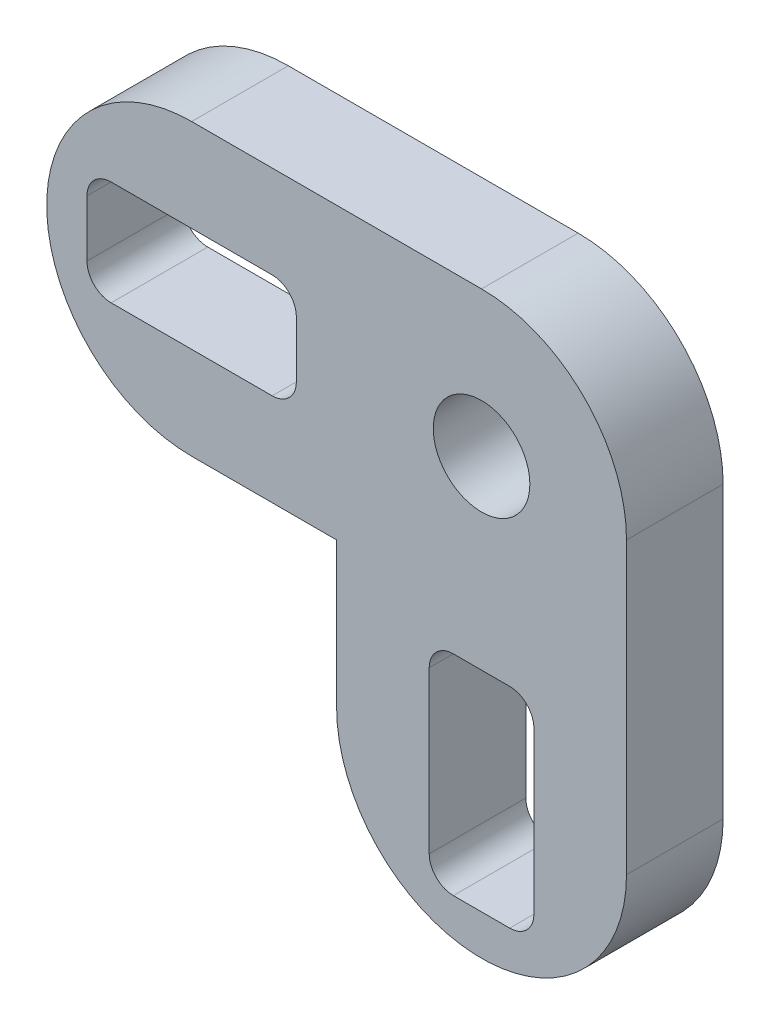
from build123d import *

# Parameters (mm, degrees)
MODEL_R                 = 1.5
SALIENTE_EXTRUIR1_DEPTH = 3


with BuildPart() as part:
    # Model → Saliente-Extruir1 (new body)
    with BuildSketch(Plane.XY):
        with BuildLine():
            Line((149.34213351, 211.823953209), (158.34213351, 211.823953209))
            ThreePointArc((158.34213351, 211.823953209), (161.524114025, 210.505933724), (162.84213351, 207.323953209))
            Line((162.84213351, 207.323953209), (162.84213351, 198.323953209))
            ThreePointArc((162.84213351, 198.323953209), (158.34213351, 193.823953209), (153.84213351, 198.323953209))
            Line((153.84213351, 198.323953209), (153.84213351, 202.823953209))
            Line((153.84213351, 202.823953209), (149.34213351, 202.823953209))
            ThreePointArc((149.34213351, 202.823953209), (144.84213351, 207.323953209), (149.34213351, 211.823953209))
        make_face()
        with Locations((158.34213351, 207.323953209)):
            Circle(MODEL_R, mode=Mode.SUBTRACT)
        with BuildLine():
            Line((156.71713351, 195.823953209), (156.71713351, 200.823953209))
            ThreePointArc((156.71713351, 200.823953209), (156.936803424, 201.354283295), (157.46713351, 201.573953209))
            Line((157.46713351, 201.573953209), (159.21713351, 201.573953209))
            ThreePointArc((159.21713351, 201.573953209), (159.747463595, 201.354283295), (159.96713351, 200.823953209))
            Line((159.96713351, 200.823953209), (159.96713351, 195.823953209))
            ThreePointArc((159.96713351, 195.823953209), (159.747463595, 195.293623123), (159.21713351, 195.073953209))
            Line((159.21713351, 195.073953209), (157.46713351, 195.073953209))
            ThreePointArc((157.46713351, 195.073953209), (156.936803424, 195.293623123), (156.71713351, 195.823953209))
        make_face(mode=Mode.SUBTRACT)
        with BuildLine():
            Line((151.84213351, 205.698953209), (146.84213351, 205.698953209))
            ThreePointArc((146.84213351, 205.698953209), (146.311803424, 205.918623123), (146.09213351, 206.448953209))
            Line((146.09213351, 206.448953209), (146.09213351, 208.198953209))
            ThreePointArc((146.09213351, 208.198953209), (146.311803424, 208.729283295), (146.84213351, 208.948953209))
            Line((146.84213351, 208.948953209), (151.84213351, 208.948953209))
            ThreePointArc((151.84213351, 208.948953209), (152.372463595, 208.729283295), (152.59213351, 208.198953209))
            Line((152.59213351, 208.198953209), (152.59213351, 206.448953209))
            ThreePointArc((152.59213351, 206.448953209), (152.372463595, 205.918623123), (151.84213351, 205.698953209))
        make_face(mode=Mode.SUBTRACT)
    extrude(amount=SALIENTE_EXTRUIR1_DEPTH)


solid = part.part
